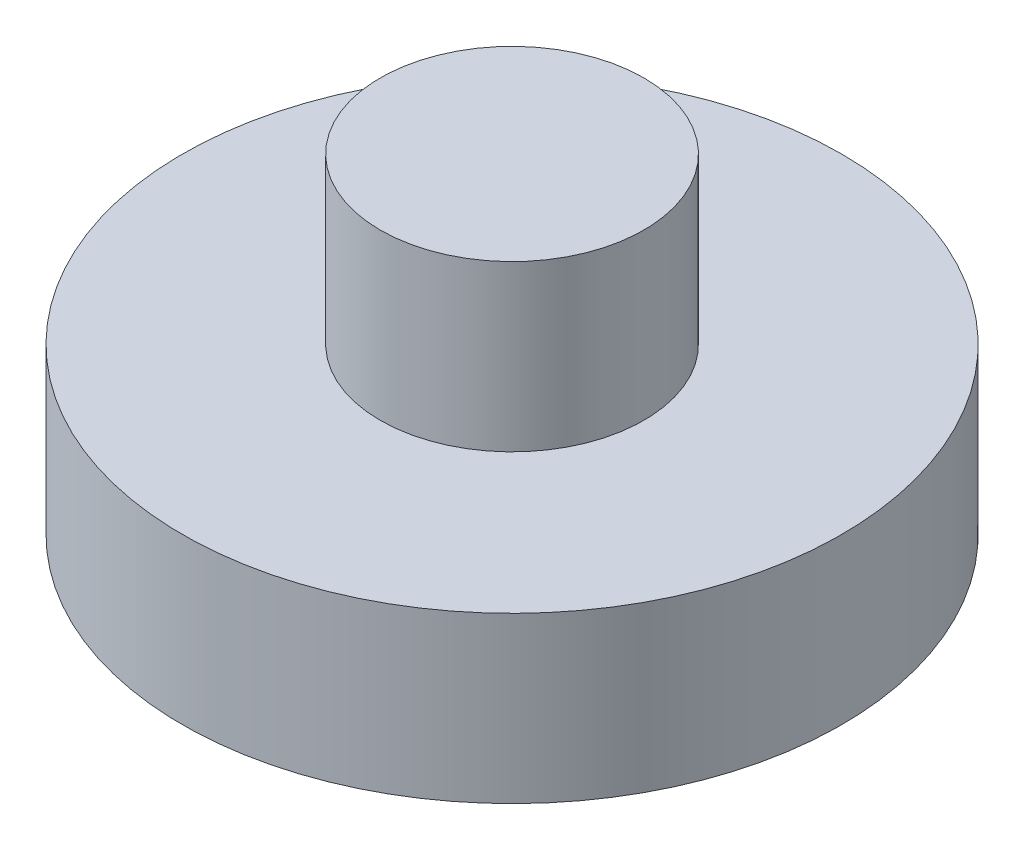
from build123d import *


with BuildPart() as part:
    # Sketch1 → Revolve1 (revolve)
    with BuildSketch(Plane.XY, mode=Mode.PRIVATE) as revolve1_sk:
        Polygon((0, 0), (0, 12.7), (5.08, 12.7), (5.08, 6.35), (12.7, 6.35), (12.7, 0), align=None)
    revolve(revolve1_sk.sketch.rotate(Axis((0, 0, 0), (0, 1, 0)), 90), axis=Axis((0, 0, 0), (0, 1, 0)))


solid = part.part
